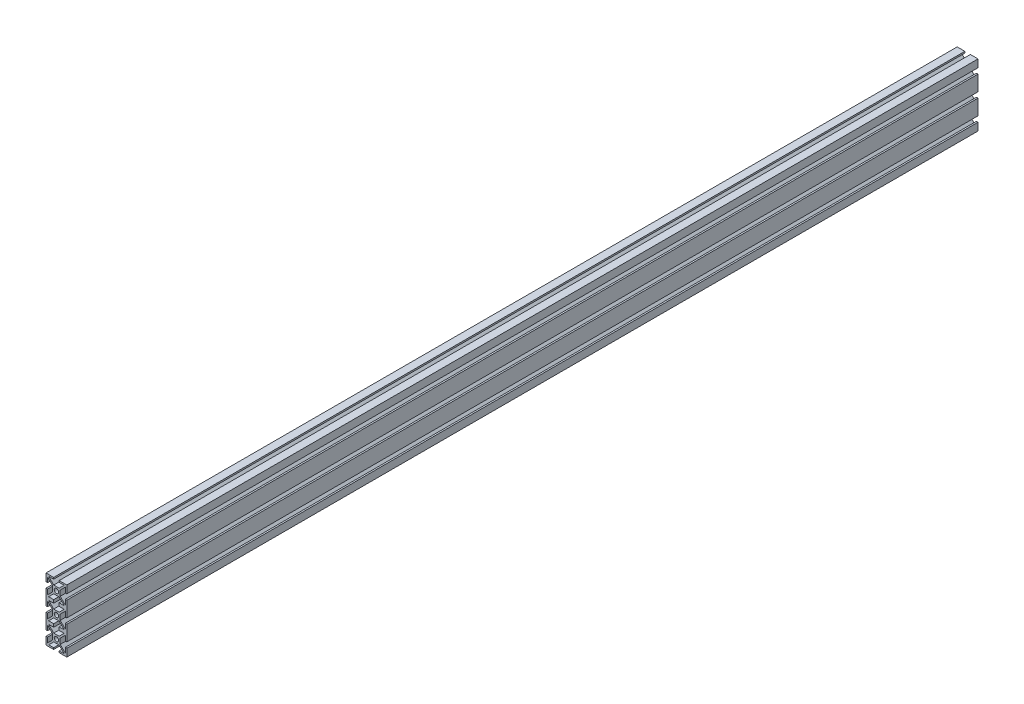
from build123d import *

# Parameters (mm, degrees)
SKETCH1_R           = 2.095
BOSS_EXTRUDE1_DEPTH = 875
LPATTERN1_COUNT     = 3
LPATTERN1_PITCH     = 20


with BuildPart() as part:
    # Sketch1 → Boss-Extrude1 (new body)
    with BuildSketch(Plane.XY):
        Polygon((6.345, 12.594339828), (1.5, 17.439339828), (1.5, 12.63), (0, 12.63), (0, 20), (7.37, 20), (7.37, 18.5), (2.560660172, 18.5), (7.405660172, 13.655), (12.594339828, 13.655), (17.439339828, 18.5), (12.63, 18.5), (12.63, 20), (20, 20), (20, 12.63), (18.5, 12.63), (18.5, 17.439339828), (13.655, 12.594339828), (13.655, 7.405660172), (18.5, 2.560660172), (18.5, 7.37), (20, 7.37), (20, 0), (12.63, 0), (12.63, 1.5), (17.439339828, 1.5), (12.594339828, 6.345), (7.405660172, 6.345), (2.560660172, 1.5), (7.37, 1.5), (7.37, 0), (0, 0), (0, 7.37), (1.5, 7.37), (1.5, 2.560660172), (6.345, 7.405660172), align=None)
        with Locations((10, 10)):
            Circle(SKETCH1_R, mode=Mode.SUBTRACT)
    boss_extrude1 = extrude(amount=BOSS_EXTRUDE1_DEPTH)

    # LPattern1: Boss-Extrude1 ×3
    with Locations(*[(0, -i * LPATTERN1_PITCH, 0) for i in range(1, LPATTERN1_COUNT)]):
        add(boss_extrude1)


solid = part.part
